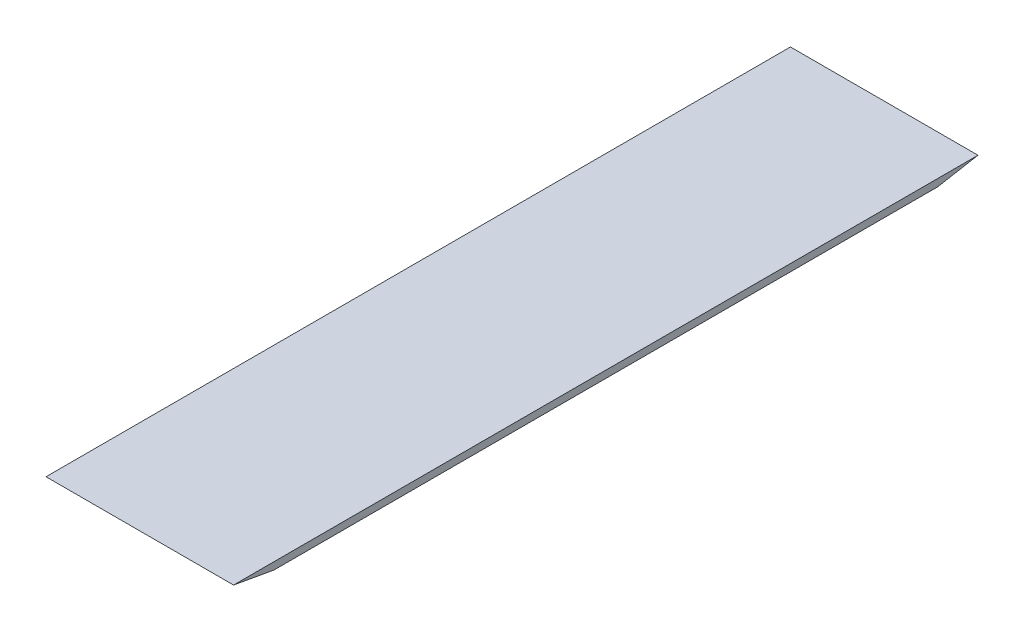
from build123d import *

# Parameters (mm, degrees)
BOSS_EXTRUDE1_DEPTH = 130


with BuildPart() as part:
    # Sketch1 → Boss-Extrude1 (new body)
    with BuildSketch(Plane(origin=(0, 0, 0), x_dir=(0, 0, -1), z_dir=(1, 0, 0))):
        Polygon((28, -5), (488, -5), (516, 0), (0, 0), align=None)
    extrude(amount=BOSS_EXTRUDE1_DEPTH)


solid = part.part
